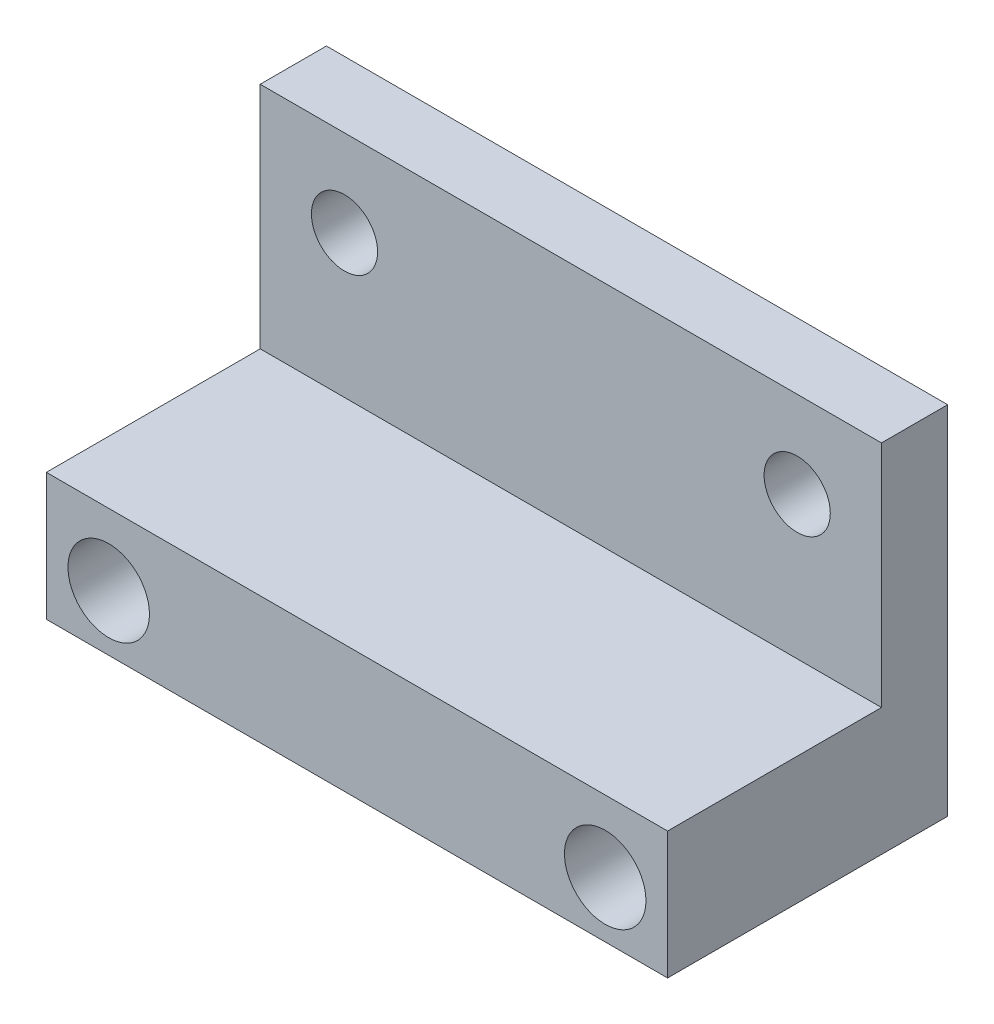
from build123d import *

# Parameters (mm, degrees)
SKETCH1_W           = 24.4
SKETCH1_H           = 14
SKETCH1_R           = 1.3
BOSS_EXTRUDE1_DEPTH = 2.6
SKETCH2_W           = 24.4
SKETCH2_H           = 5
BOSS_EXTRUDE2_DEPTH = 11
SKETCH3_R           = 1.6
CUT_EXTRUDE1_DEPTH  = 4.6


with BuildPart() as part:
    # Sketch1 → Boss-Extrude1 (new body)
    with BuildSketch(Plane.XY):
        with Locations((0, 7)):
            Rectangle(SKETCH1_W, SKETCH1_H)
        with Locations((-8.89, 10.6)):
            Circle(SKETCH1_R, mode=Mode.SUBTRACT)
        with Locations((8.89, 10.6)):
            Circle(SKETCH1_R, mode=Mode.SUBTRACT)
    extrude(amount=BOSS_EXTRUDE1_DEPTH)

    # Sketch2 → Boss-Extrude2 (add)
    with BuildSketch(Plane.XY):
        with Locations((0, 2.5)):
            Rectangle(SKETCH2_W, SKETCH2_H)
    extrude(amount=BOSS_EXTRUDE2_DEPTH)

    # Sketch3 → Cut-Extrude1 (cut)
    with BuildSketch(Plane.XY.offset(11)):
        with Locations((-9.75, 2.2)):
            Circle(SKETCH3_R)
        with Locations((9.75, 2.2)):
            Circle(SKETCH3_R)
    extrude(amount=-CUT_EXTRUDE1_DEPTH, mode=Mode.SUBTRACT)


solid = part.part
